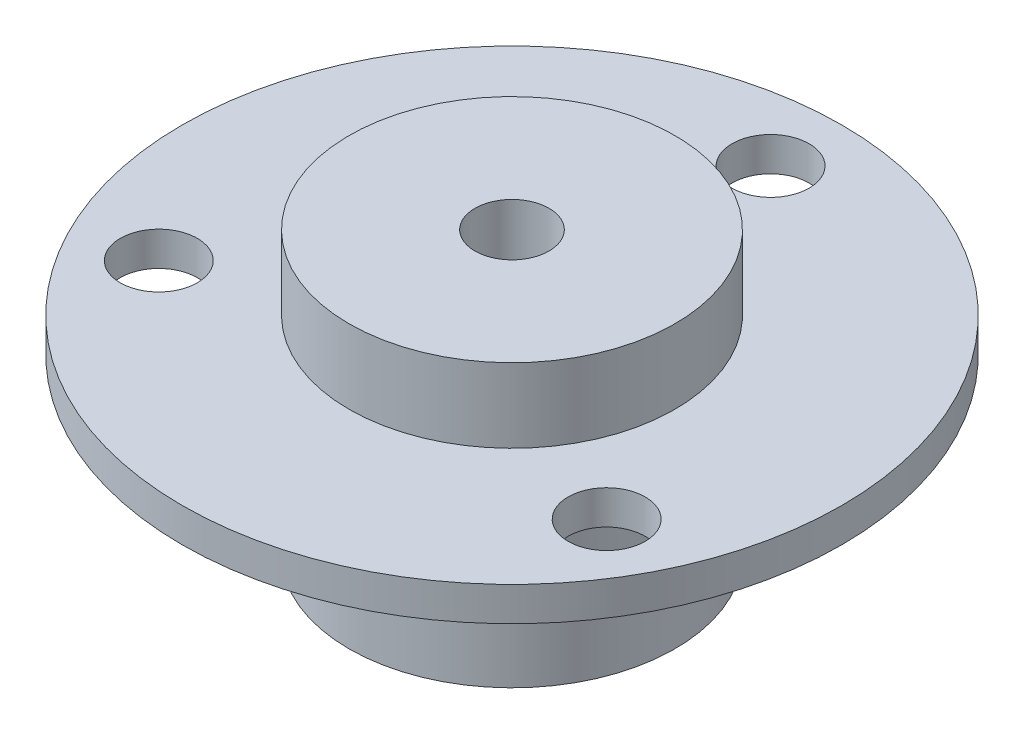
from build123d import *

# Parameters (mm, degrees)
SKETCH_1_R          = 11
EXTRUDE_1_DEPTH     = 19
SKETCH_2_R          = 22.25
EXTRUDE_2_DEPTH     = 2.3
SKETCH_3_R          = 2.6
CUT_EXTRUDE_1_DEPTH = 35.440165505
SKETCH_4_R          = 2.5
CUT_EXTRUDE_2_DEPTH = 37.757652265


with BuildPart() as part:
    # 草图1 → 凸台-拉伸1 (new body)
    with BuildSketch(Plane(origin=(0, 0, 0), x_dir=(1, 0, 0), z_dir=(0, 1, 0))):
        with Locations(Location((0, 0, 0), (0, 0, 270))):
            Circle(SKETCH_1_R)
    extrude(amount=-EXTRUDE_1_DEPTH)

    # 草图2 → 凸台-拉伸2 (add)
    with BuildSketch(Plane(origin=(0, -5, 0), x_dir=(1, 0, 0), z_dir=(0, 1, 0))):
        with Locations(Location((0, 0, 0), (0, 0, 270))):
            Circle(SKETCH_2_R)
    extrude(amount=-EXTRUDE_2_DEPTH)

    # 草图3 → 切除-拉伸1 (cut, through all)
    with BuildSketch(Plane(origin=(0, -5, 0), x_dir=(1, 0, 0), z_dir=(0, 1, 0))):
        with Locations(Location((0, 17.45, 0), (0, 0, 270))):
            Circle(SKETCH_3_R)
        with Locations(Location((15.112143296, -8.725, 0), (0, 0, 270))):
            Circle(SKETCH_3_R)
        with Locations(Location((-15.112143296, -8.725, 0), (0, 0, 270))):
            Circle(SKETCH_3_R)
    extrude(amount=-CUT_EXTRUDE_1_DEPTH, mode=Mode.SUBTRACT)

    # 草图4 → 切除-拉伸2 (cut, through all)
    with BuildSketch(Plane(origin=(0, 0, 0), x_dir=(1, 0, 0), z_dir=(0, 1, 0))):
        with Locations(Location((0, 0, 0), (0, 0, 270))):
            Circle(SKETCH_4_R)
    extrude(amount=-CUT_EXTRUDE_2_DEPTH, mode=Mode.SUBTRACT)


solid = part.part
